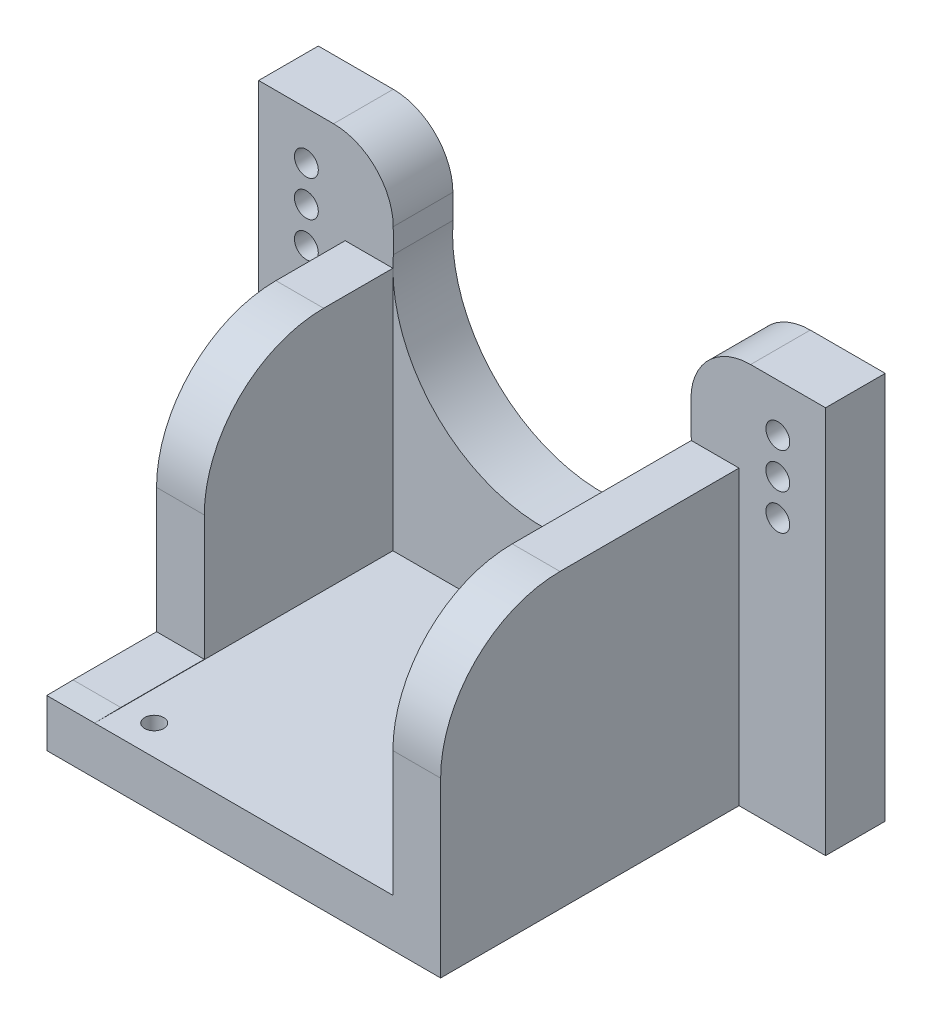
from build123d import *

# Parameters (mm, degrees)
SKETCH1_R             = 2
BOSS_EXTRUDE2_DEPTH   = 10
BOSS_EXTRUDE2_2_DEPTH = 10
BOSS_EXTRUDE2_3_DEPTH = 10
BOSS_EXTRUDE3_DEPTH   = 60
CUT_EXTRUDE1_REACH    = 111.65
FILLET3_R             = 20
FILLET4_R             = 10
FILLET5_R             = 20
SKETCH3_R             = 1.6
CUT_EXTRUDE3_DEPTH    = 96.421433651


with BuildPart() as part:
    # Sketch1 → Boss-Extrude2 (new body)
    with BuildSketch(Plane.XY):
        with BuildLine():
            Line((-47.5, 20.92242842), (-47.5, -44.07757158))
            Line((-47.5, -44.07757158), (-33, -44.07757158))
            Line((-33, -44.07757158), (-33, 4.92242842))
            Line((-33, 4.92242842), (-25, 4.92242842))
            ThreePointArc((-25, 4.92242842), (-24.979959865, 5.923230668), (-24.919871589, 6.92242842))
            Line((-24.919871589, 6.92242842), (-25, 20.92242842))
            Line((-25, 20.92242842), (-47.5, 20.92242842))
        make_face()
        with Locations((-39.5, 0.92242842)):
            Circle(SKETCH1_R, mode=Mode.SUBTRACT)
        with Locations((-39.5, 6.92242842)):
            Circle(SKETCH1_R, mode=Mode.SUBTRACT)
        with Locations((-39.5, 12.92242842)):
            Circle(SKETCH1_R, mode=Mode.SUBTRACT)
    extrude(amount=BOSS_EXTRUDE2_DEPTH)



with BuildPart() as body_2:
    # Sketch1 → Boss-Extrude2 2 (new body)
    with BuildSketch(Plane.XY):
        with BuildLine():
            Line((33, 4.92242842), (33, -44.07757158))
            Line((33, -44.07757158), (47.5, -44.07757158))
            Line((47.5, -44.07757158), (47.5, 20.92242842))
            Line((47.5, 20.92242842), (25, 20.92242842))
            Line((25, 20.92242842), (24.919871589, 6.92242842))
            ThreePointArc((24.919871589, 6.92242842), (24.979959865, 5.923230668), (25, 4.92242842))
            Line((25, 4.92242842), (33, 4.92242842))
        make_face()
        with Locations((39.5, 0.92242842)):
            Circle(SKETCH1_R, mode=Mode.SUBTRACT)
        with Locations((39.5, 6.92242842)):
            Circle(SKETCH1_R, mode=Mode.SUBTRACT)
        with Locations((39.5, 12.92242842)):
            Circle(SKETCH1_R, mode=Mode.SUBTRACT)
    extrude(amount=BOSS_EXTRUDE2_2_DEPTH)


with BuildPart() as body_3:
    # Sketch1 → Boss-Extrude2 3 (new body)
    with BuildSketch(Plane.XY):
        with BuildLine():
            ThreePointArc((25, 4.92242842), (0, -20.07757158), (-25, 4.92242842))
            Line((-25, 4.92242842), (-25, -36.07757158))
            Line((-25, -36.07757158), (25, -36.07757158))
            Line((25, -36.07757158), (25, 4.92242842))
        make_face()
    extrude(amount=BOSS_EXTRUDE2_3_DEPTH)


with BuildPart() as part_1:
    add(part.part)

    add(body_2.part)  # Boss-Extrude3 merges body 2

    add(body_3.part)  # Boss-Extrude3 merges body 3
    # Sketch1<8> → Boss-Extrude3 (add)
    with BuildSketch(Plane.XY):
        Polygon((-33, -44.07757158), (33, -44.07757158), (33, 4.92242842), (25, 4.92242842), (25, -36.07757158), (-25, -36.07757158), (-25, 4.92242842), (-33, 4.92242842), align=None)
    extrude(amount=BOSS_EXTRUDE3_DEPTH)

    # Sketch2 → Cut-Extrude1 (cut, up to next)
    with BuildSketch(Plane.ZY.offset(33), mode=Mode.PRIVATE) as cut_extrude1_sk1:
        Polygon((41.60617838, -22.329937261), (41.60617838, 4.92242842), (60, 4.92242842), (60, -36.07757158), (55.59382162, -36.025205899), (41.60617838, -36.025205899), align=None)
    cut_extrude1_tool1 = extrude(cut_extrude1_sk1.sketch, amount=-CUT_EXTRUDE1_REACH, mode=Mode.PRIVATE) & part_1.part
    add(cut_extrude1_tool1.solids().sort_by_distance((-33, -15.554527, 50.804273))[0], mode=Mode.SUBTRACT)

    # Fillet3
    fillet3_edges = [part_1.edges().sort_by_distance(p)[0] for p in [
        (29, 4.92242842, 60),
    ]]
    fillet(fillet3_edges, radius=FILLET3_R)

    # Fillet4
    fillet4_edges = [part_1.edges().sort_by_distance(p)[0] for p in [
        (25, 20.92242842, 5),
        (-25, 20.92242842, 5),
    ]]
    fillet(fillet4_edges, radius=FILLET4_R)

    # Fillet5
    fillet5_edges = [part_1.edges().sort_by_distance(p)[0] for p in [
        (-29, 4.92242842, 41.60617838),
    ]]
    fillet(fillet5_edges, radius=FILLET5_R)

    # Sketch3 → Cut-Extrude3 (cut, through all)
    with BuildSketch(Plane(origin=(0, -36.07757158, 0), x_dir=(1, 0, 0), z_dir=(0, 1, 0))):
        with Locations((-20, -55)):
            Circle(SKETCH3_R)
        with Locations((20, -15)):
            Circle(SKETCH3_R)
    extrude(amount=-CUT_EXTRUDE3_DEPTH, mode=Mode.SUBTRACT)


solid = part_1.part
